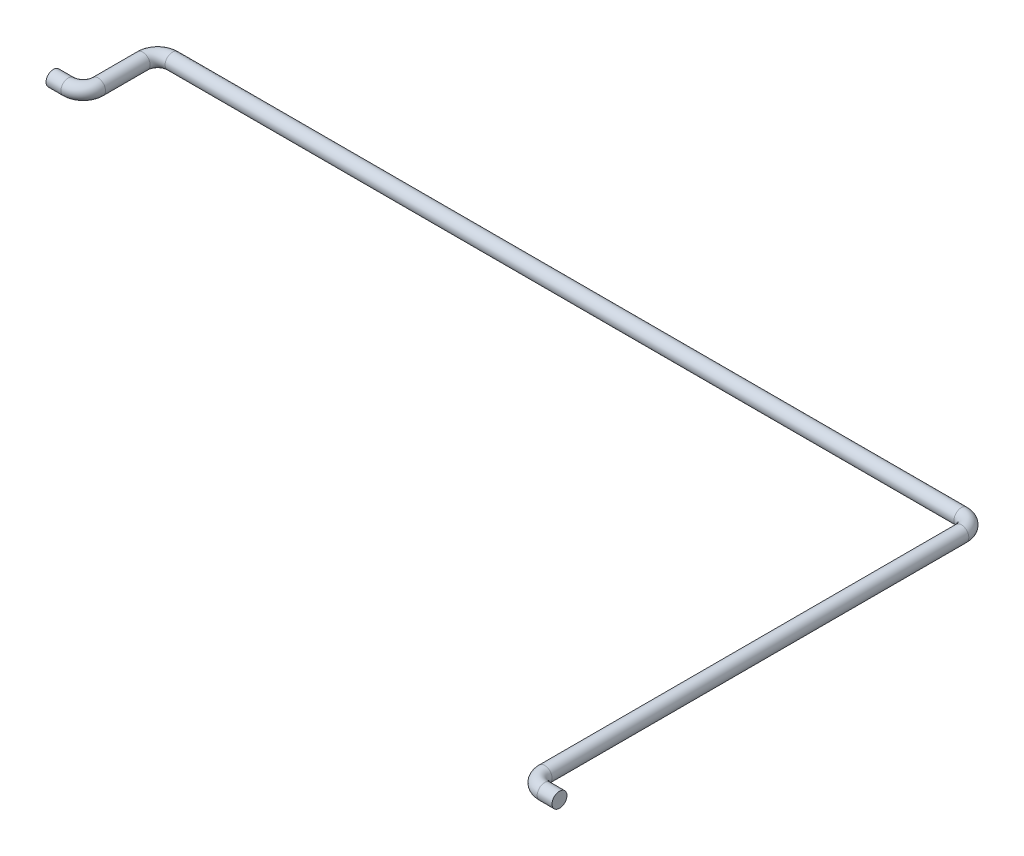
from build123d import *

# Parameters (mm, degrees)
SKETCH2_R = 0.5


with BuildPart() as part:
    # Sweep1: sweep along a path in Sketch1
    with BuildLine(Plane(origin=(0, 0, 0), x_dir=(1, 0, 0), z_dir=(0, 1, 0))) as sweep1_path:
        Line((59, -25), (58, -25))
        ThreePointArc((58, -25), (57.292893219, -24.707106781), (57, -24))
        Line((57, -24), (57, 4))
        ThreePointArc((57, 4), (56.707106781, 4.707106781), (56, 5))
        Line((56, 5), (3, 5))
        ThreePointArc((3, 5), (2.292893219, 4.707106781), (2, 4))
        Line((2, 4), (2, 1))
        ThreePointArc((2, 1), (1.707106781, 0.292893219), (1, 0))
        Line((1, 0), (0, 0))
    # Sketch2 → Sweep1 (sweep)
    with BuildSketch(Plane(origin=(0, 0, 0), x_dir=(0, 0, -1), z_dir=(1, 0, 0))):
        Circle(SKETCH2_R)
    sweep(path=sweep1_path.line)


solid = part.part
